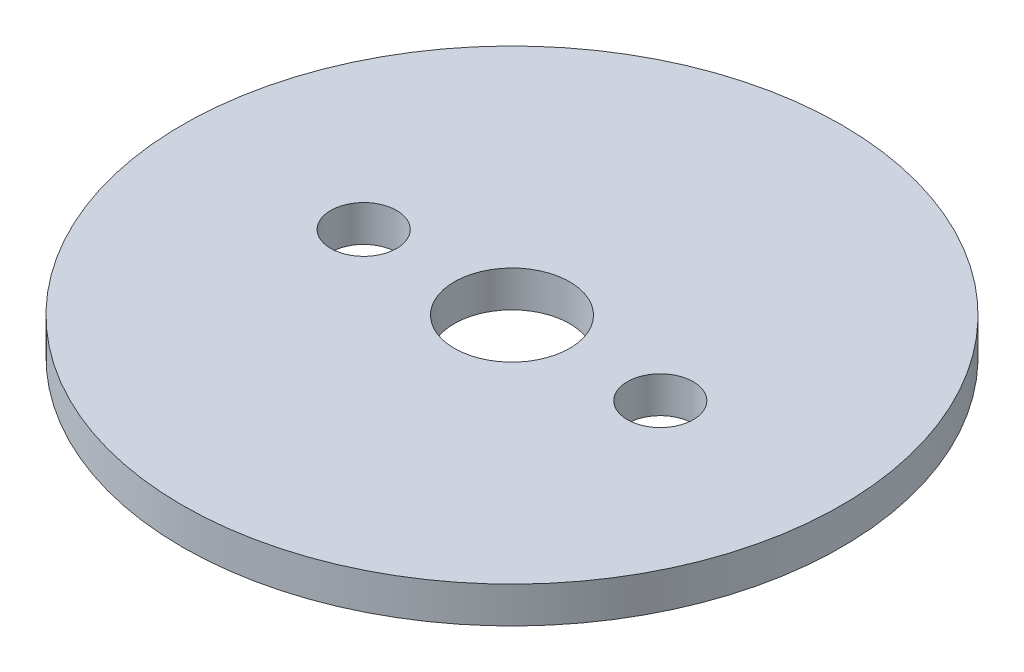
from build123d import *

# Parameters (mm, degrees)
SKETCH_1_R      = 100
SKETCH_1_R_2    = 17.5
SKETCH_1_R_3    = 10
EXTRUDE_1_DEPTH = 11


with BuildPart() as part:
    # Эскиз1 → Бобышка-Вытянуть1 (new body)
    with BuildSketch(Plane(origin=(0, 0, 0), x_dir=(1, 0, 0), z_dir=(0, 1, 0))):
        with Locations(Location((0, 0, 0), (0, 0, 270))):
            Circle(SKETCH_1_R)
        with Locations(Location((0, 0, 0), (0, 0, 270))):
            Circle(SKETCH_1_R_2, mode=Mode.SUBTRACT)
        with Locations(Location((-45, 0, 0), (0, 0, 270))):
            Circle(SKETCH_1_R_3, mode=Mode.SUBTRACT)
        with Locations(Location((45, 0, 0), (0, 0, 270))):
            Circle(SKETCH_1_R_3, mode=Mode.SUBTRACT)
    extrude(amount=-EXTRUDE_1_DEPTH)


solid = part.part
